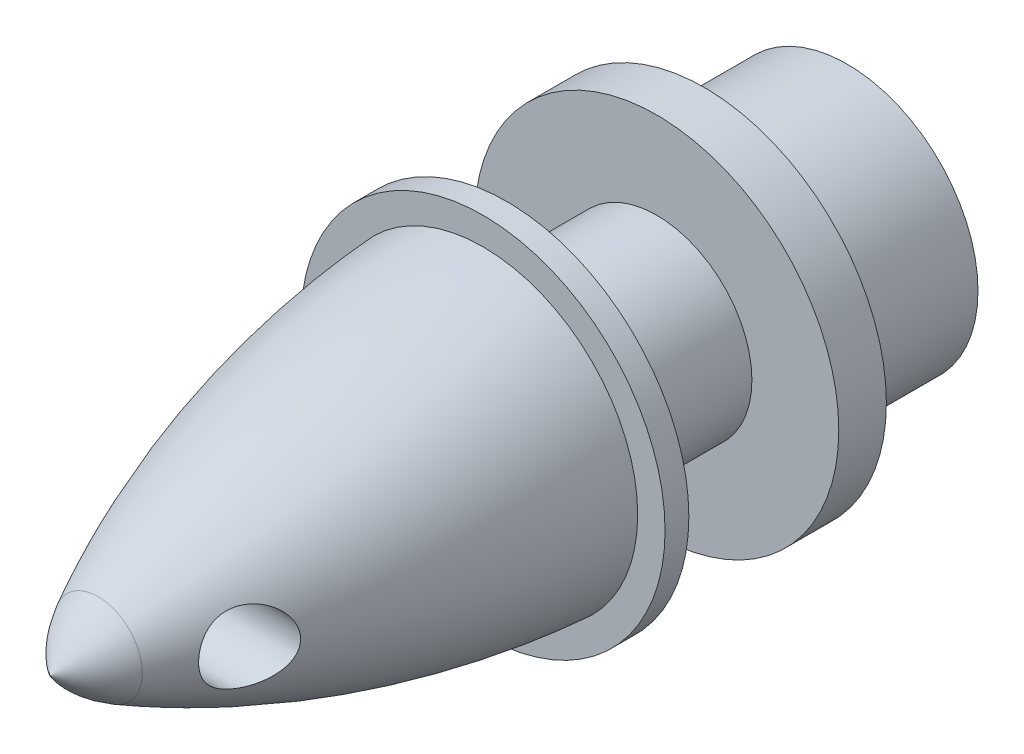
from build123d import *

# Parameters (mm, degrees)
SKETCH_2_R          = 1.5
CUT_EXTRUDE_1_DEPTH = 24.941073563


with BuildPart() as part:
    # Эскиз1 → Повернуть1 (revolve)
    with BuildSketch(Plane(origin=(0, 0, 0), x_dir=(0, 0, -1), z_dir=(1, 0, 0)), mode=Mode.PRIVATE) as revolve_1_sk:
        with BuildLine():
            Line((-16.75, 0), (16.75, 0))
            Line((16.75, 0), (16.75, 5.5))
            Line((16.75, 5.5), (11.95, 5.5))
            Line((11.95, 5.5), (10.75, 7.65))
            Line((10.75, 7.65), (8.75, 7.65))
            Line((8.75, 7.65), (8.75, 4))
            Line((8.75, 4), (2.45, 4))
            Line((2.45, 4), (2.45, 7.65))
            Line((2.45, 7.65), (1.45, 7.65))
            Line((1.45, 7.65), (1.45, 6.5))
            ThreePointArc((1.45, 6.5), (-6.880526727, 5.027063991), (-14.723327208, 1.855676812))
            ThreePointArc((-14.723327208, 1.855676812), (-15.854421467, 1.056447361), (-16.75, 0))
        make_face()
    revolve(revolve_1_sk.sketch.rotate(Axis((0, 0, -16.75), (0, 0, -1)), 90), axis=Axis((0, 0, -16.75), (0, 0, -1)))

    # Эскиз2 → Вырез-Вытянуть1 (cut, through all)
    with BuildSketch(Plane(origin=(7.65, 0, 0), x_dir=(0, 0, -1), z_dir=(1, 0, 0))):
        with Locations((-11.65, 0)):
            Circle(SKETCH_2_R)
    extrude(amount=-CUT_EXTRUDE_1_DEPTH, mode=Mode.SUBTRACT)


solid = part.part
